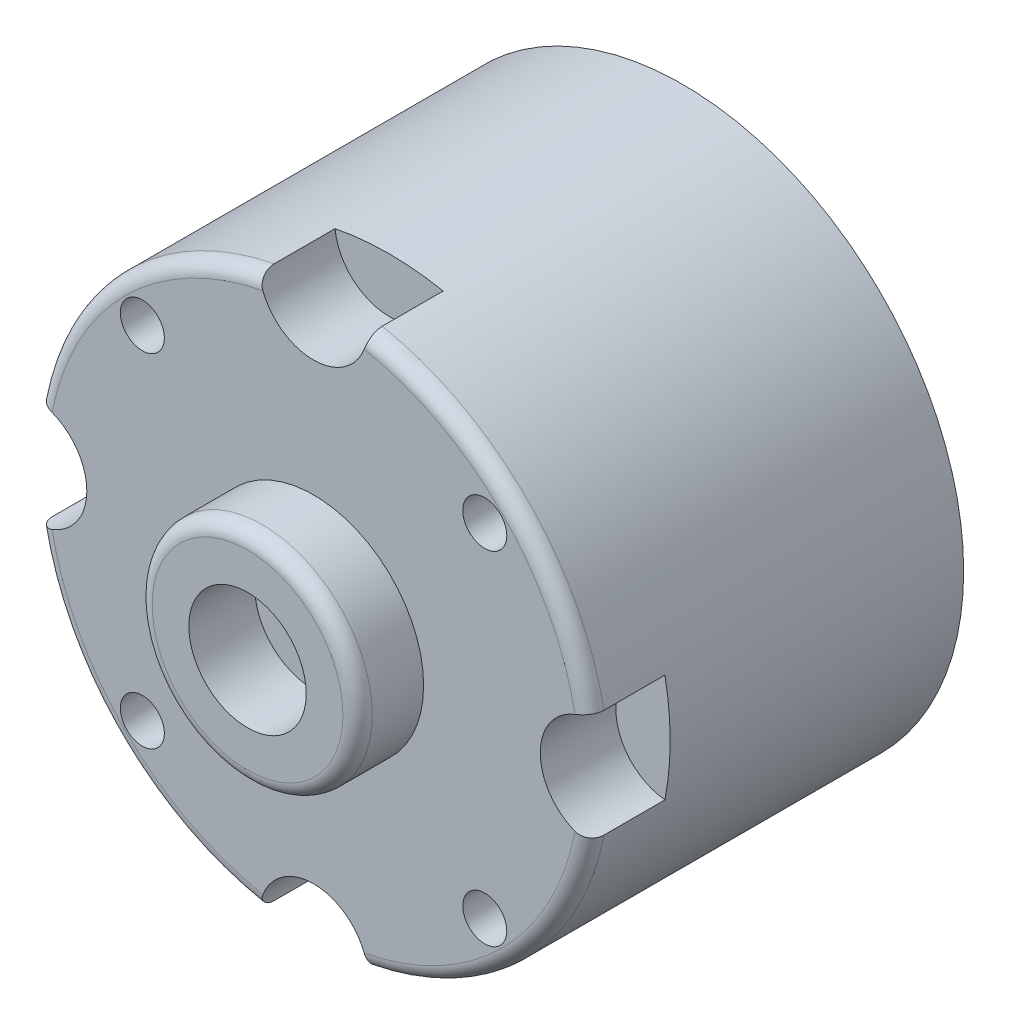
from build123d import *

# Parameters (mm, degrees)
SKETCH2_R           = 19.15
BOSS_EXTRUDE1_DEPTH = 25.15
SKETCH3_R           = 1.5
SKETCH3_R_2         = 3.7
CUT_EXTRUDE1_DEPTH  = 5.15
SKETCH4_R           = 7.5
BOSS_EXTRUDE2_DEPTH = 4.5
SKETCH5_R           = 4
CUT_EXTRUDE2_DEPTH  = 4.5
FILLET1_R           = 1


with BuildPart() as part:
    # Sketch2 → Boss-Extrude1 (new body)
    with BuildSketch(Plane.XY):
        with Locations(Location((0, 0, 0), (0, 0, 180))):
            Circle(SKETCH2_R)
    extrude(amount=BOSS_EXTRUDE1_DEPTH)

    # Sketch3 → Cut-Extrude1 (cut)
    with BuildSketch(Plane.XY.offset(25.15)):
        with Locations((11.66726189, 11.66726189)):
            Circle(SKETCH3_R)
        with Locations((-11.66726189, -11.66726189)):
            Circle(SKETCH3_R)
        with Locations((11.66726189, -11.66726189)):
            Circle(SKETCH3_R)
        with Locations((-11.66726189, 11.66726189)):
            Circle(SKETCH3_R)
        with Locations((0, 19.15)):
            Circle(SKETCH3_R_2)
        with Locations((0, -19.15)):
            Circle(SKETCH3_R_2)
        with Locations((-19.15, 0)):
            Circle(SKETCH3_R_2)
        with Locations((19.15, 0)):
            Circle(SKETCH3_R_2)
    extrude(amount=-CUT_EXTRUDE1_DEPTH, mode=Mode.SUBTRACT)

    # Sketch4 → Boss-Extrude2 (add)
    with BuildSketch(Plane.XY.offset(25.15)):
        Circle(SKETCH4_R)
    extrude(amount=BOSS_EXTRUDE2_DEPTH)

    # Sketch5 → Cut-Extrude2 (cut)
    with BuildSketch(Plane.XY.offset(29.65)):
        Circle(SKETCH5_R)
    extrude(amount=-CUT_EXTRUDE2_DEPTH, mode=Mode.SUBTRACT)

    # Fillet1
    fillet1_edges = [part.edges().sort_by_distance(p)[0] for p in [
        (13.54109486, 13.54109486, 25.15),
        (-7.5, 0, 29.65),
        (-13.54109486, 13.54109486, 25.15),
        (-13.54109486, -13.54109486, 25.15),
        (13.54109486, -13.54109486, 25.15),
    ]]
    fillet(fillet1_edges, radius=FILLET1_R)


solid = part.part
